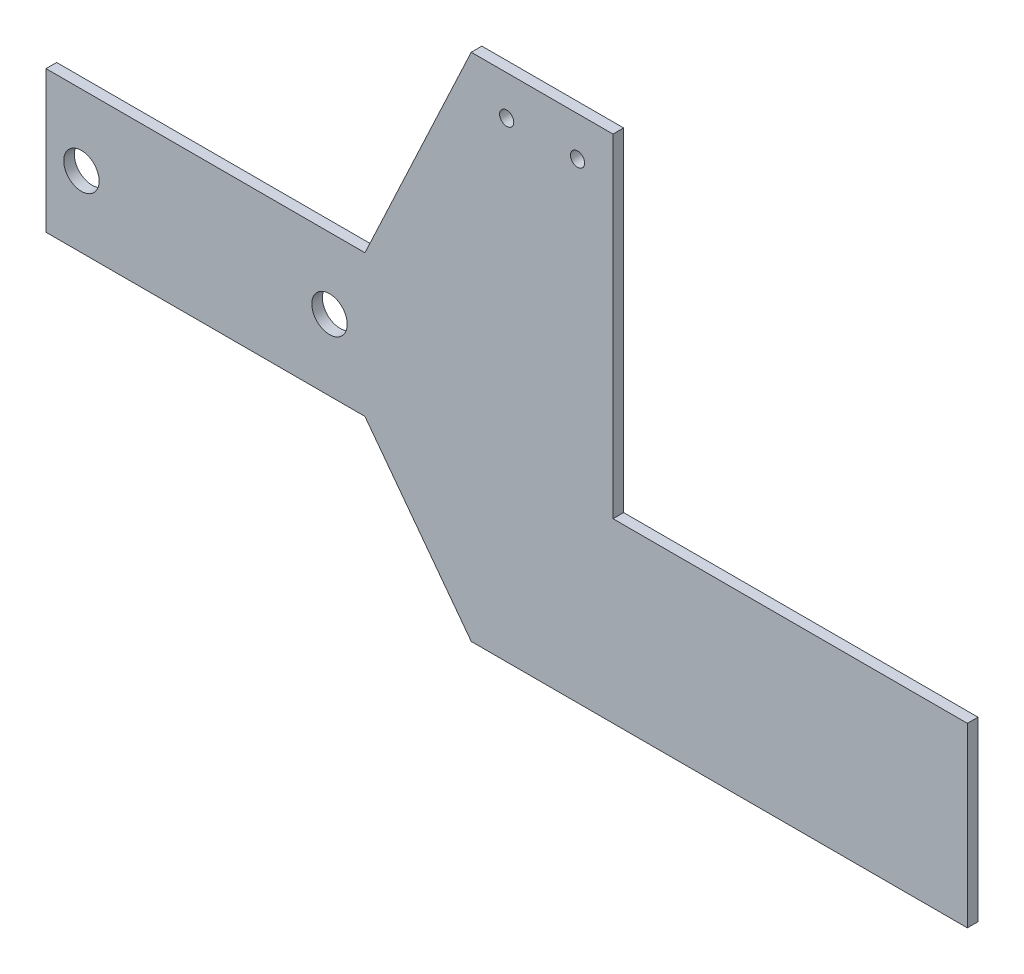
from build123d import *

# Parameters (mm, degrees)
SKETCH1_R           = 1
BOSS_EXTRUDE1_DEPTH = 1.5


with BuildPart() as part:
    # Sketch1 → Boss-Extrude1 (new body)
    # profile 1 of 5: a face of its own
    with BuildSketch(Plane.XY):
        Polygon((0, 72), (-20, 72), (-35, 40), (-57.5, 40), (-57.5, 30), (-57.5, 20), (-35, 20), (-20, 0), (0, 0), (50, 0), (50, 25), (0, 25), align=None)
        with BuildLine():
            ThreePointArc((-40, 27.5), (-41.767766953, 28.232233047), (-42.5, 30))
            ThreePointArc((-42.5, 30), (-41.767766953, 31.767766953), (-40, 32.5))
            ThreePointArc((-40, 32.5), (-38.232233047, 31.767766953), (-37.5, 30))
            ThreePointArc((-37.5, 30), (-38.232233047, 28.232233047), (-40, 27.5))
        make_face(mode=Mode.SUBTRACT)
        with Locations((-15, 66.44)):
            Circle(SKETCH1_R, mode=Mode.SUBTRACT)
        with Locations((-5, 66.44)):
            Circle(SKETCH1_R, mode=Mode.SUBTRACT)
    # profile 2 of 5: a face of its own
    with BuildSketch(Plane.XY):
        with BuildLine():
            Line((-57.5, 30), (-57.5, 40))
            Line((-57.5, 40), (-75, 40))
            Line((-75, 40), (-75, 32.5))
            ThreePointArc((-75, 32.5), (-73.232233047, 31.767766953), (-72.5, 30))
            Line((-72.5, 30), (-57.5, 30))
        make_face()
    # profile 3 of 5: a face of its own
    with BuildSketch(Plane.XY):
        with BuildLine():
            Line((-57.5, 20), (-57.5, 30))
            Line((-57.5, 30), (-72.5, 30))
            ThreePointArc((-72.5, 30), (-73.232233047, 28.232233047), (-75, 27.5))
            Line((-75, 27.5), (-75, 20))
            Line((-75, 20), (-57.5, 20))
        make_face()
    # profile 4 of 5: a face of its own
    with BuildSketch(Plane.XY):
        with BuildLine():
            Line((-77.5, 30), (-80, 30))
            Line((-80, 30), (-80, 20))
            Line((-80, 20), (-75, 20))
            Line((-75, 20), (-75, 27.5))
            ThreePointArc((-75, 27.5), (-76.767766953, 28.232233047), (-77.5, 30))
        make_face()
    # profile 5 of 5: a face of its own
    with BuildSketch(Plane.XY):
        with BuildLine():
            Line((-75, 32.5), (-75, 40))
            Line((-75, 40), (-80, 40))
            Line((-80, 40), (-80, 30))
            Line((-80, 30), (-77.5, 30))
            ThreePointArc((-77.5, 30), (-76.767766953, 31.767766953), (-75, 32.5))
        make_face()
    extrude(amount=BOSS_EXTRUDE1_DEPTH)


solid = part.part
